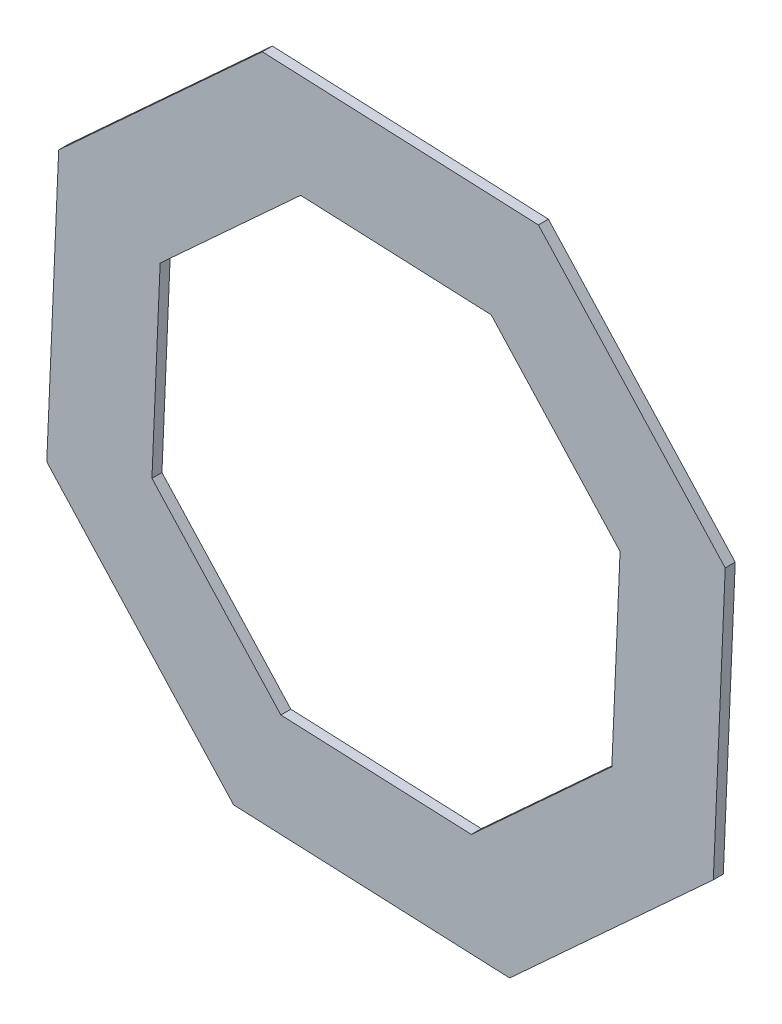
from build123d import *

# Parameters (mm, degrees)
SALIENTE_EXTRUIR1_DEPTH = 3
CORTAR_EXTRUIR1_DEPTH   = 3


with BuildPart() as part:
    # Croquis1 → Saliente-Extruir1 (new body)
    with BuildSketch(Plane.XY):
        Polygon((-45.692015403, -98.122211965), (37.073747528, -101.692015403), (98.122211965, -45.692015403), (101.692015403, 37.073747528), (45.692015403, 98.122211965), (-37.073747528, 101.692015403), (-98.122211965, 45.692015403), (-101.692015403, -37.073747528), align=None)
    extrude(amount=SALIENTE_EXTRUIR1_DEPTH)

    # Croquis2 → Cortar-Extruir1 (cut)
    with BuildSketch(Plane(origin=(0, 0, 0), x_dir=(-1, 0, 0), z_dir=(0, 0, -1))):
        Polygon((-67.704326256, -31.527490628), (-25.580885794, -70.167490628), (31.527490628, -67.704326256), (70.167490628, -25.580885794), (67.704326256, 31.527490628), (25.580885794, 70.167490628), (-31.527490628, 67.704326256), (-70.167490628, 25.580885794), align=None)
    extrude(amount=-CORTAR_EXTRUIR1_DEPTH, mode=Mode.SUBTRACT)


solid = part.part
